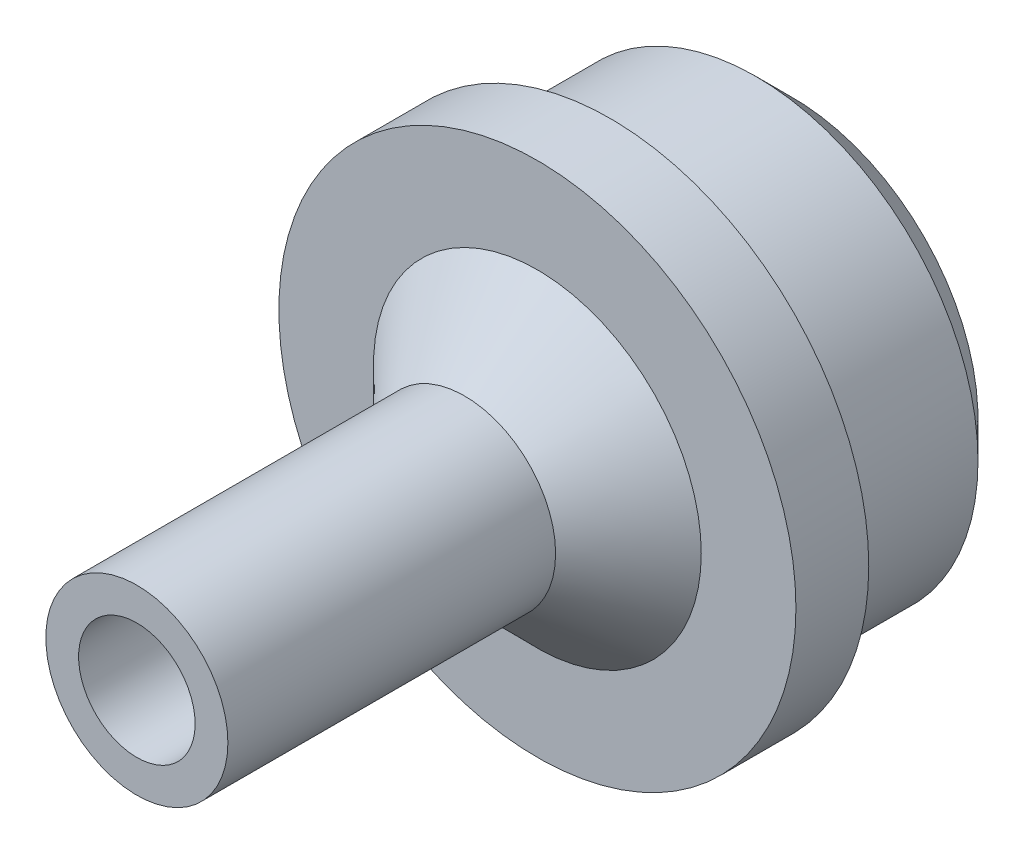
from build123d import *

# Parameters (mm, degrees)
EXTRUDE_1_DEPTH     = 5
SKETCH_2_R          = 7.1
EXTRUDE_2_DEPTH     = 2
SKETCH_3_R          = 2.5
EXTRUDE_3_DEPTH     = 7
CHAMFER_1_SIZE      = 2
SKETCH_4_R          = 1.6
CUT_EXTRUDE_1_DEPTH = 30
CHAMFER_2_SIZE      = 1
MOVE_FACE_1_BY      = 4


with BuildPart() as part:
    # ｽｹｯﾁ1 → ﾎﾞｽ - 押し出し1 (new body)
    with BuildSketch(Plane.XY):
        with BuildLine():
            Line((-6.35, -0.875), (-6.036917674, -0.875))
            ThreePointArc((-6.036917674, -0.875), (6.1, 0), (-6.036917674, 0.875))
            Line((-6.036917674, 0.875), (-6.35, 0.875))
            Line((-6.35, 0.875), (-6.35, -0.875))
        make_face()
    extrude(amount=-EXTRUDE_1_DEPTH)

    # ｽｹｯﾁ2 → ﾎﾞｽ - 押し出し2 (add)
    with BuildSketch(Plane.XY):
        Circle(SKETCH_2_R)
    extrude(amount=EXTRUDE_2_DEPTH)

    # ｽｹｯﾁ3 → ﾎﾞｽ - 押し出し3 (add)
    with BuildSketch(Plane.XY.offset(2)):
        Circle(SKETCH_3_R)
    extrude(amount=EXTRUDE_3_DEPTH)

    # 面取り1
    chamfer_1_edges = [part.edges().sort_by_distance(p)[0] for p in [
        (-2.5, 0, 2),
    ]]
    chamfer(chamfer_1_edges, length=CHAMFER_1_SIZE)

    # ｽｹｯﾁ4 → ｶｯﾄ - 押し出し1 (cut)
    with BuildSketch(Plane.XY.offset(9)):
        Circle(SKETCH_4_R)
    extrude(amount=-CUT_EXTRUDE_1_DEPTH, mode=Mode.SUBTRACT)

    # 面取り2
    chamfer_2_edges = [part.edges().sort_by_distance(p)[0] for p in [
        (6.1, 0, -5),
    ]]
    chamfer(chamfer_2_edges, length=CHAMFER_2_SIZE)

    # Move Face 1: a face moved outward by 4.0
    extrude(part.faces().sort_by_distance((0, -2, 9))[0], amount=MOVE_FACE_1_BY, dir=(0, 0, 1))


solid = part.part
